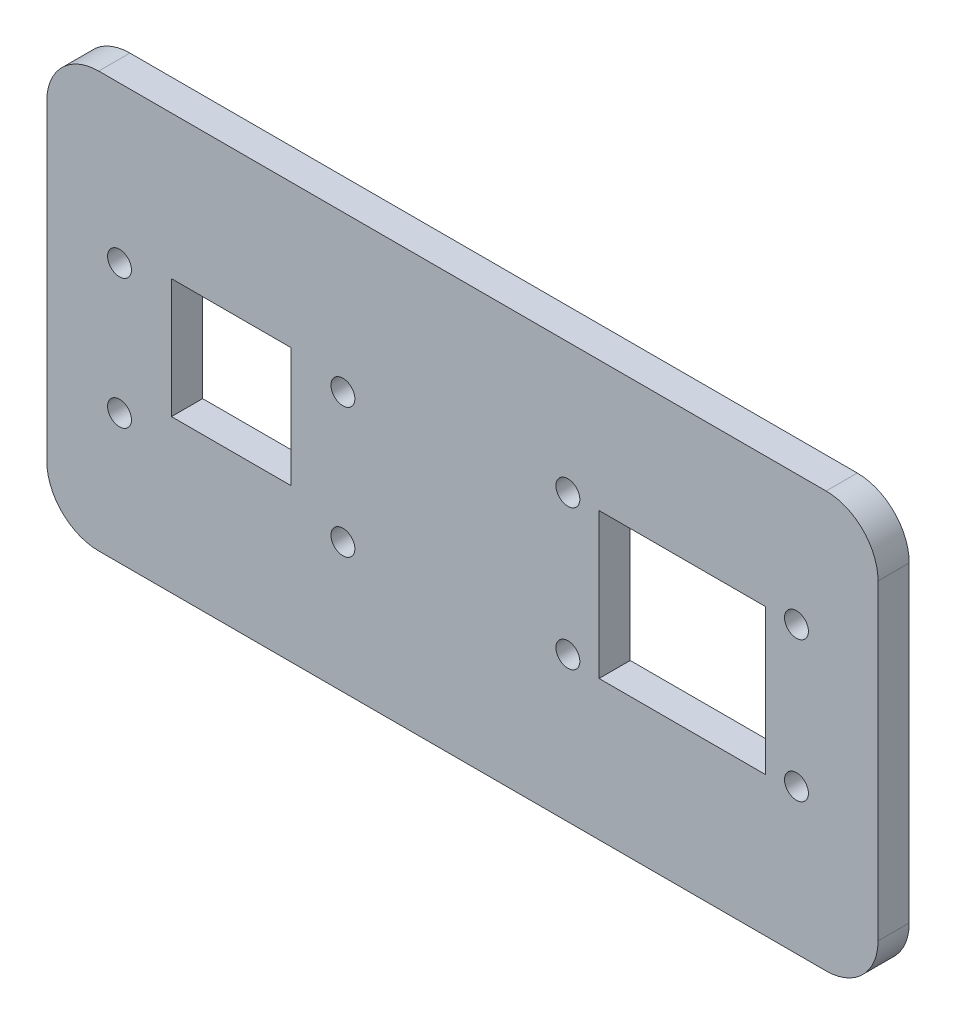
from build123d import *

# Parameters (mm, degrees)
SKETCH1_W           = 80
SKETCH1_H           = 40
SKETCH1_R           = 1.15
SKETCH1_W_2         = 11.5
SKETCH1_H_2         = 11.5
SKETCH1_W_3         = 16
SKETCH1_H_3         = 14
BOSS_EXTRUDE1_DEPTH = 3
FILLET1_R           = 5


with BuildPart() as part:
    # Sketch1 → Boss-Extrude1 (new body)
    with BuildSketch(Plane.XY):
        Rectangle(SKETCH1_W, SKETCH1_H)
        with Locations((-11.5, 5)):
            Circle(SKETCH1_R, mode=Mode.SUBTRACT)
        with Locations((-11.5, -7.5)):
            Circle(SKETCH1_R, mode=Mode.SUBTRACT)
        with Locations((-33, 5)):
            Circle(SKETCH1_R, mode=Mode.SUBTRACT)
        with Locations((-33, -7.5)):
            Circle(SKETCH1_R, mode=Mode.SUBTRACT)
        with Locations((10.15, 7.45)):
            Circle(SKETCH1_R, mode=Mode.SUBTRACT)
        with Locations((10.15, -6.05)):
            Circle(SKETCH1_R, mode=Mode.SUBTRACT)
        with Locations((32.15, 7.45)):
            Circle(SKETCH1_R, mode=Mode.SUBTRACT)
        with Locations((32.15, -6.05)):
            Circle(SKETCH1_R, mode=Mode.SUBTRACT)
        with Locations((-22.25, 0.45)):
            Rectangle(SKETCH1_W_2, SKETCH1_H_2, mode=Mode.SUBTRACT)
        with Locations((21.15, 0.45)):
            Rectangle(SKETCH1_W_3, SKETCH1_H_3, mode=Mode.SUBTRACT)
    extrude(amount=BOSS_EXTRUDE1_DEPTH)

    # Fillet1
    fillet1_edges = [part.edges().sort_by_distance(p)[0] for p in [
        (40, -20, 1.5),
        (-40, -20, 1.5),
        (-40, 20, 1.5),
        (40, 20, 1.5),
    ]]
    fillet(fillet1_edges, radius=FILLET1_R)


solid = part.part
